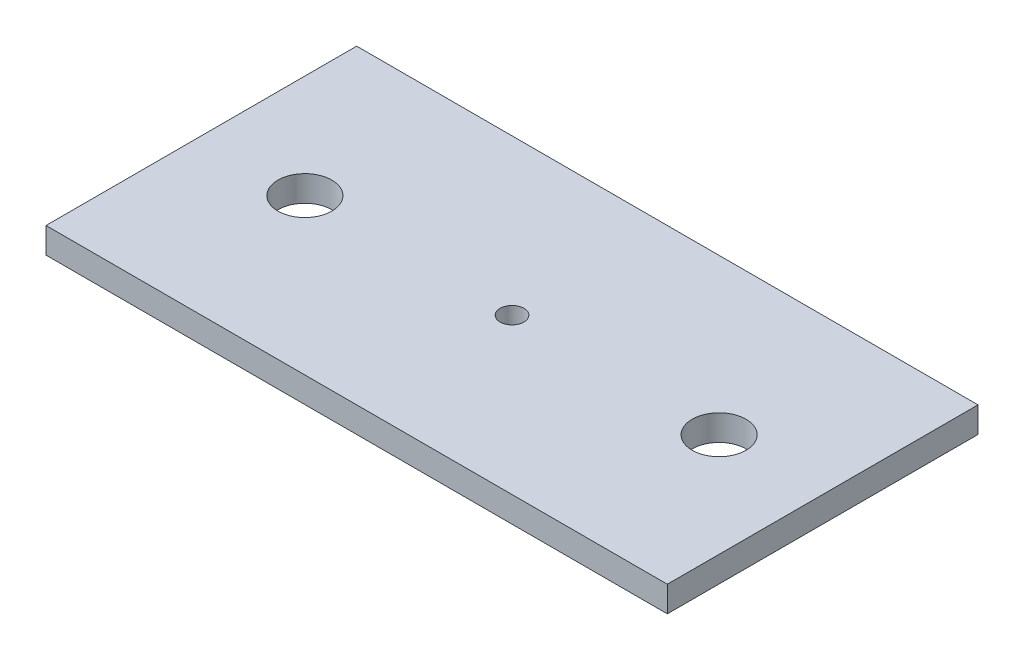
from build123d import *

# Parameters (mm, degrees)
SKETCH1_W           = 76.2
SKETCH1_H           = 38.1
BOSS_EXTRUDE1_DEPTH = 3.1496
SKETCH4_R           = 3.302
SKETCH4_R_2         = 1.4605
CUT_EXTRUDE2_DEPTH  = 86.252389879


with BuildPart() as part:
    # Sketch1 → Boss-Extrude1 (new body)
    with BuildSketch(Plane(origin=(0, 0, 0), x_dir=(1, 0, 0), z_dir=(0, 1, 0))):
        with Locations((38.1, 19.05)):
            Rectangle(SKETCH1_W, SKETCH1_H)
    extrude(amount=BOSS_EXTRUDE1_DEPTH)

    # Sketch4 → Cut-Extrude2 (cut, through all)
    with BuildSketch(Plane(origin=(0, 3.1496, 0), x_dir=(1, 0, 0), z_dir=(0, 1, 0))):
        with Locations(Location((12.7, 19.05, 0), (0, 0, 270))):
            Circle(SKETCH4_R)
        with Locations(Location((63.5, 19.05, 0), (0, 0, 270))):
            Circle(SKETCH4_R)
        with Locations(Location((38.1, 19.05, 0), (0, 0, 270))):
            Circle(SKETCH4_R_2)
    extrude(amount=-CUT_EXTRUDE2_DEPTH, mode=Mode.SUBTRACT)


solid = part.part
